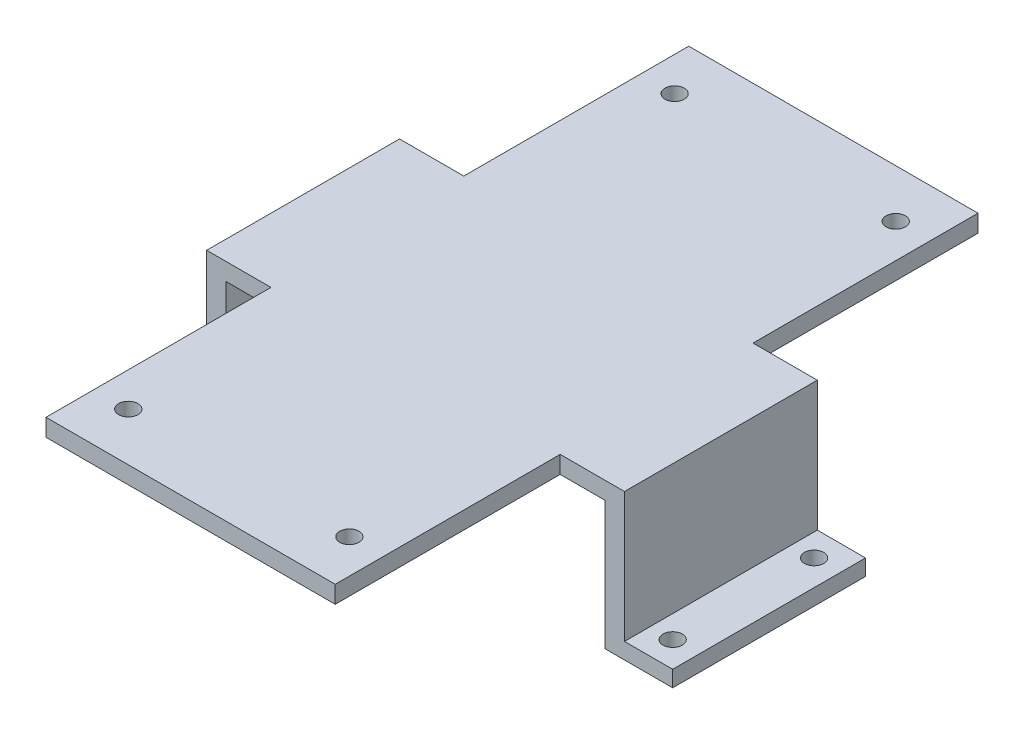
from build123d import *

# Parameters (mm, degrees)
SKETCH1_W            = 45
SKETCH1_H            = 100
BOSS_EXTRUDE1_DEPTH  = 2.70166895
SKETCH2_R            = 1.5
CUT_EXTRUDE1_DEPTH   = 2.70166895
LPATTERN1_COUNT      = 2
LPATTERN1_PITCH      = 85
LPATTERN1_COUNT_DIR2 = 2
LPATTERN1_PITCH_DIR2 = 34.4
SKETCH4_W            = 30
SKETCH4_H            = 2.70166895
BOSS_EXTRUDE2_DEPTH  = 10
SKETCH6_W            = 3
SKETCH6_H            = 30
BOSS_EXTRUDE3_DEPTH  = 20
SKETCH7_W            = 30
SKETCH7_H            = 2.5
BOSS_EXTRUDE4_DEPTH  = 7.5
SKETCH14_W           = 3
SKETCH14_H           = 30
BOSS_EXTRUDE5_DEPTH  = 20
SKETCH15_W           = 30
SKETCH15_H           = 2.5
BOSS_EXTRUDE6_DEPTH  = 7.5
SKETCH16_R           = 1.5
CUT_EXTRUDE2_DEPTH   = 2.5
LPATTERN2_COUNT      = 2
LPATTERN2_PITCH      = 22
LPATTERN2_COUNT_DIR2 = 2
LPATTERN2_PITCH_DIR2 = 72


with BuildPart() as part:
    # Sketch1 → Boss-Extrude1 (new body)
    with BuildSketch(Plane(origin=(0, 0, 0), x_dir=(1, 0, 0), z_dir=(0, 1, 0))):
        with Locations((-22.5, 50)):
            Rectangle(SKETCH1_W, SKETCH1_H)
    extrude(amount=BOSS_EXTRUDE1_DEPTH)

    # Sketch2 → Cut-Extrude1 (cut)
    with BuildSketch(Plane(origin=(0, 2.70166895, 0), x_dir=(1, 0, 0), z_dir=(0, 1, 0))):
        with Locations(Location((-39.7, 92.5, 0), (0, 0, 270))):
            Circle(SKETCH2_R)
    cut_extrude1 = extrude(amount=-CUT_EXTRUDE1_DEPTH, mode=Mode.SUBTRACT)

    # LPattern1: Cut-Extrude1 2 × 2
    with Locations(*[(j * LPATTERN1_PITCH_DIR2, 0, i * LPATTERN1_PITCH) for i in range(LPATTERN1_COUNT) for j in range(LPATTERN1_COUNT_DIR2) if (i, j) != (0, 0)]):
        add(cut_extrude1, mode=Mode.SUBTRACT)

    # Sketch4 → Boss-Extrude2 (add)
    with BuildSketch(Plane(origin=(0, 0, 0), x_dir=(0, 0, -1), z_dir=(1, 0, 0))):
        with Locations((50, 1.350834475)):
            Rectangle(SKETCH4_W, SKETCH4_H)
    boss_extrude2 = extrude(amount=BOSS_EXTRUDE2_DEPTH)

    # Sketch6 → Boss-Extrude3 (add)
    with BuildSketch(Plane.XZ):
        with Locations((8.5, -50)):
            Rectangle(SKETCH6_W, SKETCH6_H)
    extrude(amount=BOSS_EXTRUDE3_DEPTH)

    # Sketch7 → Boss-Extrude4 (add)
    with BuildSketch(Plane(origin=(10, 0, 0), x_dir=(0, 0, -1), z_dir=(1, 0, 0))):
        with Locations((50, -18.75)):
            Rectangle(SKETCH7_W, SKETCH7_H)
    extrude(amount=BOSS_EXTRUDE4_DEPTH)

    # Mirror2: Boss-Extrude2 across plane
    add(boss_extrude2.mirror(Plane.ZY.offset(22.5)))

    # Sketch14 → Boss-Extrude5 (add)
    with BuildSketch(Plane.XZ):
        with Locations((-53.5, -50)):
            Rectangle(SKETCH14_W, SKETCH14_H)
    extrude(amount=BOSS_EXTRUDE5_DEPTH)

    # Sketch15 → Boss-Extrude6 (add)
    with BuildSketch(Plane.ZY.offset(55)):
        with Locations((-50, -18.75)):
            Rectangle(SKETCH15_W, SKETCH15_H)
    extrude(amount=BOSS_EXTRUDE6_DEPTH)

    # Sketch16 → Cut-Extrude2 (cut)
    with BuildSketch(Plane(origin=(0, -17.5, 0), x_dir=(1, 0, 0), z_dir=(0, 1, 0))):
        with Locations(Location((-58.5, 61, 0), (0, 0, 270))):
            Circle(SKETCH16_R)
    cut_extrude2 = extrude(amount=-CUT_EXTRUDE2_DEPTH, mode=Mode.SUBTRACT)

    # LPattern2: Cut-Extrude2 2 × 2
    with Locations(*[(j * LPATTERN2_PITCH_DIR2, 0, i * LPATTERN2_PITCH) for i in range(LPATTERN2_COUNT) for j in range(LPATTERN2_COUNT_DIR2) if (i, j) != (0, 0)]):
        add(cut_extrude2, mode=Mode.SUBTRACT)


solid = part.part
